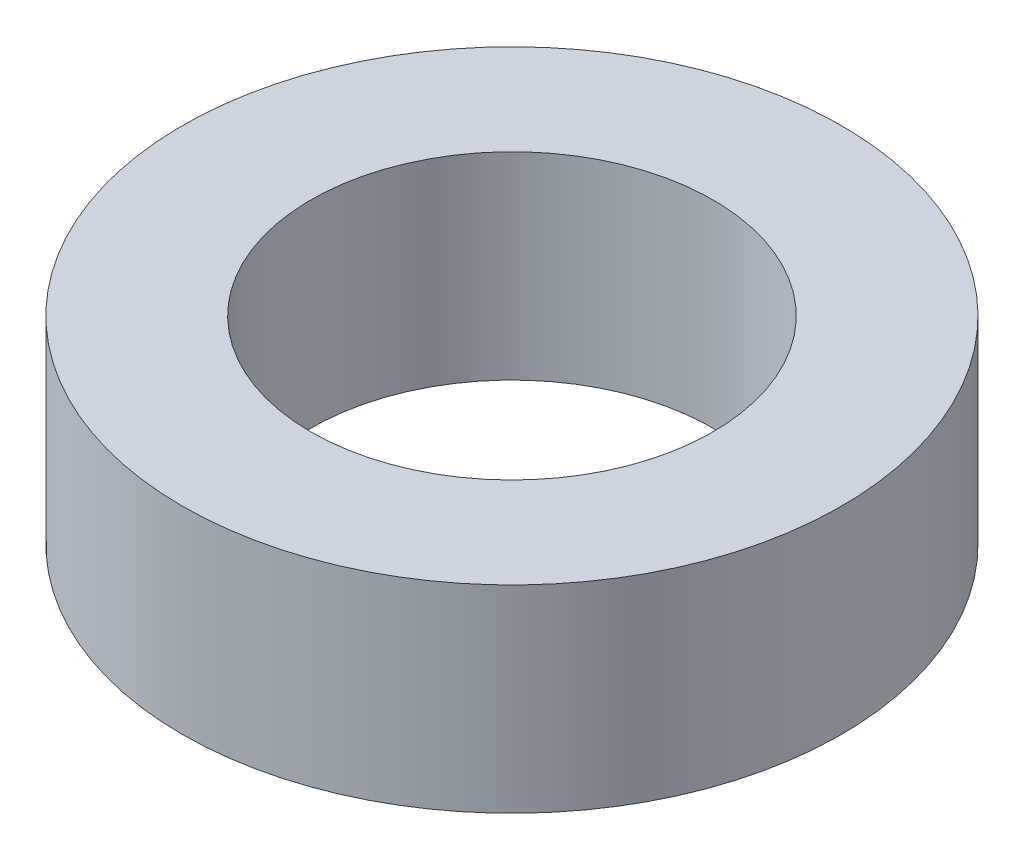
from build123d import *

# Parameters (mm, degrees)
SKETCH1_R           = 5
SKETCH1_R_2         = 3.05
BOSS_EXTRUDE1_DEPTH = 1.5


with BuildPart() as part:
    # Sketch1 → Boss-Extrude1 (new, symmetric)
    with BuildSketch(Plane(origin=(0, 0, 0), x_dir=(1, 0, 0), z_dir=(0, 1, 0))):
        with Locations(Location((0, 0, 0), (0, 0, 270))):
            Circle(SKETCH1_R)
        with Locations(Location((0, 0, 0), (0, 0, 270))):
            Circle(SKETCH1_R_2, mode=Mode.SUBTRACT)
    extrude(amount=BOSS_EXTRUDE1_DEPTH, both=True)


solid = part.part
